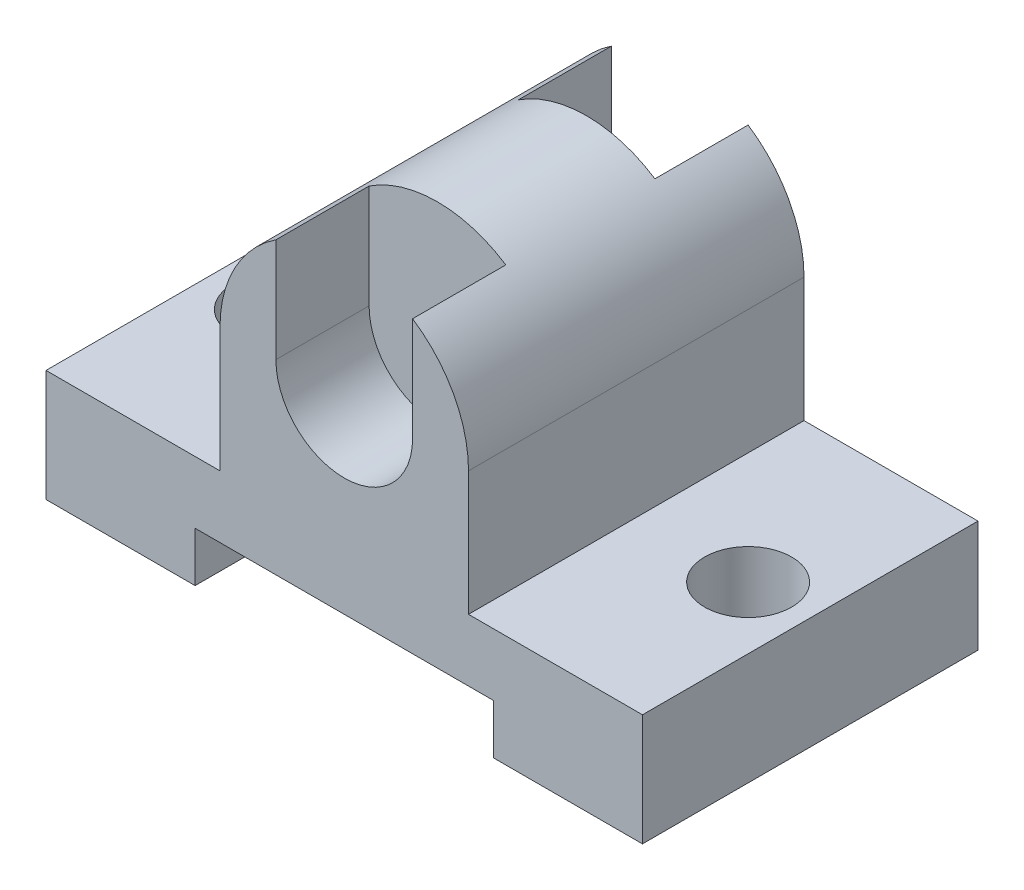
from build123d import *

# Parameters (mm, degrees)
BOSS_EXTRUDE1_DEPTH = 54
SKETCH2_R           = 7
CUT_EXTRUDE1_DEPTH  = 54
CUT_EXTRUDE2_DEPTH  = 15
CUT_EXTRUDE3_START  = -15
CUT_EXTRUDE3_DEPTH  = 15


with BuildPart() as part:
    # Sketch1 → Boss-Extrude1 (new body)
    with BuildSketch(Plane.XY):
        with BuildLine():
            Line((-48.791461113, 0), (-24.791461113, 0))
            Line((-24.791461113, 0), (-24.791461113, 8))
            Line((-24.791461113, 8), (23.208538887, 8))
            Line((23.208538887, 8), (23.208538887, 0))
            Line((23.208538887, 0), (47.208538887, 0))
            Line((47.208538887, 0), (47.208538887, 18))
            Line((47.208538887, 18), (19.208538887, 18))
            Line((19.208538887, 18), (19.208538887, 38))
            ThreePointArc((19.208538887, 38), (-0.791461113, 58), (-20.791461113, 38))
            Line((-20.791461113, 38), (-20.791461113, 18))
            Line((-20.791461113, 18), (-48.791461113, 18))
            Line((-48.791461113, 18), (-48.791461113, 0))
        make_face()
    extrude(amount=-BOSS_EXTRUDE1_DEPTH)

    # Sketch2 → Cut-Extrude1 (cut)
    with BuildSketch(Plane(origin=(0, 18, 0), x_dir=(1, 0, 0), z_dir=(0, 1, 0))):
        with Locations(Location((37.208538887, 27, 0), (0, 0, 180))):
            Circle(SKETCH2_R)
        with Locations(Location((-38.791461113, 27, 0), (0, 0, 180))):
            Circle(SKETCH2_R)
    extrude(amount=-CUT_EXTRUDE1_DEPTH, mode=Mode.SUBTRACT)

    # Sketch3 → Cut-Extrude2 (cut)
    with BuildSketch(Plane.XY):
        with BuildLine():
            Line((10.208538887, 58), (10.208538887, 38))
            ThreePointArc((10.208538887, 38), (-0.791461113, 27), (-11.791461113, 38))
            Line((-11.791461113, 38), (-11.791461113, 58))
            ThreePointArc((-11.791461113, 58), (-0.791461113, 69), (10.208538887, 58))
        make_face()
    extrude(amount=-CUT_EXTRUDE2_DEPTH, mode=Mode.SUBTRACT)

    # Sketch4 → Cut-Extrude3 (cut)
    with BuildSketch(Plane(origin=(0, 0, -54), x_dir=(-1, 0, 0), z_dir=(0, 0, -1)).offset(CUT_EXTRUDE3_START)):
        with BuildLine():
            Line((11.791461113, 58), (11.791461113, 38))
            ThreePointArc((11.791461113, 38), (0.791461113, 27), (-10.208538887, 38))
            Line((-10.208538887, 38), (-10.208538887, 58))
            ThreePointArc((-10.208538887, 58), (0.791461113, 69), (11.791461113, 58))
        make_face()
    extrude(amount=CUT_EXTRUDE3_DEPTH, mode=Mode.SUBTRACT)


solid = part.part
